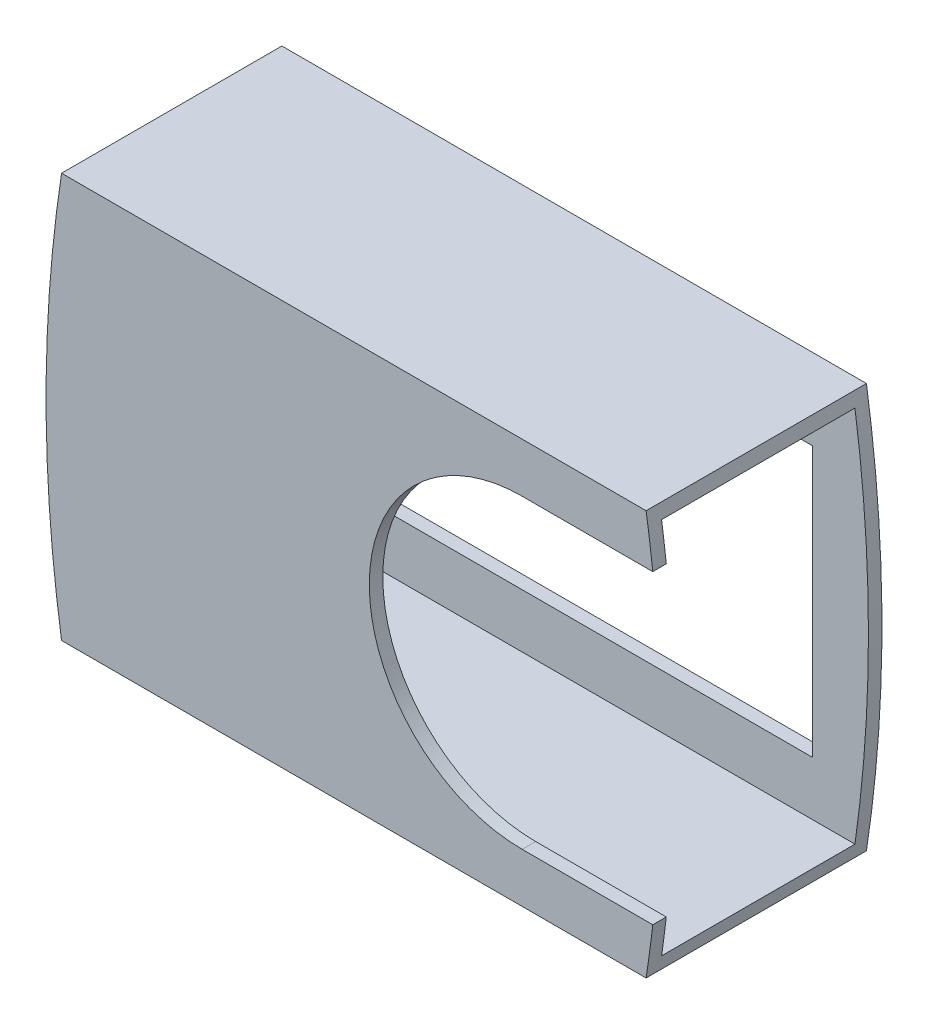
from build123d import *

# Parameters (mm, degrees)
SALIENTE_EXTRUIR1_DEPTH    = 21.5
SALIENTE_EXTRUIR2_DEPTH    = 1.5
SALIENTE_EXTRUIR3_START    = 1.5
CROQUIS3_W                 = 50
CROQUIS3_H                 = 30
SALIENTE_EXTRUIR3_DEPTH    = 1.5
CORTAR_EXTRUIR1_START      = -1.5
CORTAR_EXTRUIR1_DEPTH      = 1.5
CORTAR_EXTRUIR2_DEPTH      = 1.5
CORTAR_EXTRUIR2_DEPTH_BACK = 3
CROQUIS7_W                 = 21.5
CROQUIS7_H                 = 42
CORTAR_EXTRUIR3_DEPTH      = 10
CORTAR_EXTRUIR3_DEPTH_BACK = 10
CROQUIS8_R                 = 8


with BuildPart() as part:
    # Croquis1 → Saliente-Extruir1 (new body)
    with BuildSketch(Plane.XY):
        with BuildLine():
            Line((-63.5, 43.5), (1.5, 43.5))
            ThreePointArc((1.5, 43.5), (3.220302161, 21), (1.5, -1.5))
            Line((1.5, -1.5), (-63.5, -1.5))
            ThreePointArc((-63.5, -1.5), (-65.220302161, 21), (-63.5, 43.5))
        make_face()
        with BuildLine():
            Line((0, 0), (-62, 0))
            ThreePointArc((-62, 0), (-63.497440295, 21), (-62, 42))
            Line((-62, 42), (0, 42))
            ThreePointArc((0, 42), (1.497440295, 21), (0, 0))
        make_face(mode=Mode.SUBTRACT)
    extrude(amount=SALIENTE_EXTRUIR1_DEPTH)

    # Croquis2 → Saliente-Extruir2 (add)
    with BuildSketch(Plane.XY.offset(21.5)):
        with BuildLine():
            Line((-63.5, 43.5), (1.5, 43.5))
            ThreePointArc((1.5, 43.5), (3.220302161, 21), (1.5, -1.5))
            Line((1.5, -1.5), (-63.5, -1.5))
            ThreePointArc((-63.5, -1.5), (-65.220302161, 21), (-63.5, 43.5))
        make_face()
    extrude(amount=SALIENTE_EXTRUIR2_DEPTH)

    # Croquis3 → Saliente-Extruir3 (add)
    with BuildSketch(Plane(origin=(0, 0, 0), x_dir=(-1, 0, 0), z_dir=(0, 0, -1)).offset(SALIENTE_EXTRUIR3_START)):
        with BuildLine():
            Line((-1.5, 43.5), (63.5, 43.5))
            ThreePointArc((63.5, 43.5), (65.220302161, 21), (63.5, -1.5))
            Line((63.5, -1.5), (-1.5, -1.5))
            ThreePointArc((-1.5, -1.5), (-3.220302161, 21), (-1.5, 43.5))
        make_face()
        with Locations((28, 21)):
            Rectangle(CROQUIS3_W, CROQUIS3_H, mode=Mode.SUBTRACT)
    extrude(amount=-SALIENTE_EXTRUIR3_DEPTH)

    # Croquis4 → Cortar-Extruir1 (cut)
    with BuildSketch(Plane.XY.offset(23).offset(CORTAR_EXTRUIR1_START)):
        with BuildLine():
            Line((-12.279697839, 38), (2.240708907, 38))
            ThreePointArc((2.240708907, 38), (3.220302161, 21), (2.240708907, 4))
            Line((2.240708907, 4), (-12.279697839, 4))
            ThreePointArc((-12.279697839, 4), (-29.279697839, 21), (-12.279697839, 38))
        make_face()
    extrude(amount=CORTAR_EXTRUIR1_DEPTH, mode=Mode.SUBTRACT)

    # Croquis7 → Cortar-Extruir2 (cut, two sides: drawn at the far end of the back side and taken through both)
    with BuildSketch(Plane.ZY.offset(-1.5).offset(-CORTAR_EXTRUIR2_DEPTH_BACK)):
        with Locations((10.75, 21)):
            Rectangle(CROQUIS7_W, CROQUIS7_H)
    extrude(amount=CORTAR_EXTRUIR2_DEPTH + CORTAR_EXTRUIR2_DEPTH_BACK, mode=Mode.SUBTRACT)

    # Croquis8 → Cortar-Extruir3 (cut, two sides: drawn at the far end of the back side and taken through both)
    with BuildSketch(Plane.ZY.offset(63.5).offset(-CORTAR_EXTRUIR3_DEPTH_BACK)):
        with Locations((10.75, 21)):
            Circle(CROQUIS8_R)
    extrude(amount=CORTAR_EXTRUIR3_DEPTH + CORTAR_EXTRUIR3_DEPTH_BACK, mode=Mode.SUBTRACT)


solid = part.part
